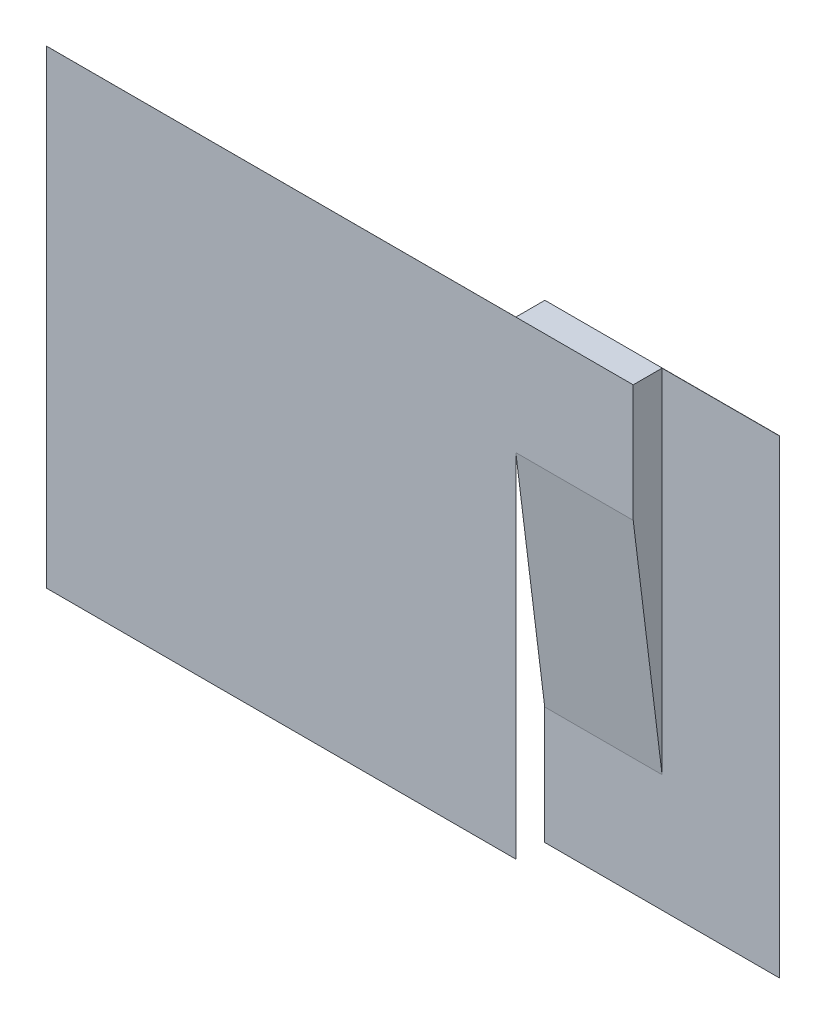
from build123d import *

# Parameters (mm, degrees)
SKETCH1_W           = 1220
SKETCH1_H           = 2440
BOSS_EXTRUDE1_DEPTH = 1
SKETCH2_W           = 610
SKETCH2_H           = 150
BOSS_EXTRUDE2_DEPTH = 1830
SKETCH3_W           = 0.1
SKETCH3_H           = 1830
BOSS_EXTRUDE3_DEPTH = 2440
SKETCH4_W           = 2440
SKETCH4_H           = 0.1
BOSS_EXTRUDE4_DEPTH = 610
DRAFT1_ANGLE        = 82.990615743


with BuildPart() as part:
    # Sketch1 → Boss-Extrude1 (new body)
    with BuildSketch(Plane(origin=(0, 0, -425.609273672), x_dir=(-1, 0, 0), z_dir=(0, 0, -1))):
        with Locations((-305, -681.820483208)):
            Rectangle(SKETCH1_W, SKETCH1_H)
    extrude(amount=-BOSS_EXTRUDE1_DEPTH)

    # Sketch2 → Boss-Extrude2 (add)
    with BuildSketch(Plane(origin=(0, 538.179516792, 0), x_dir=(1, 0, 0), z_dir=(0, 1, 0))):
        with Locations((0, 349.609273672)):
            Rectangle(SKETCH2_W, SKETCH2_H)
    extrude(amount=-BOSS_EXTRUDE2_DEPTH)

    # Sketch3 → Boss-Extrude3 (add)
    with BuildSketch(Plane.ZY.offset(305)):
        with Locations((-274.659273672, -376.820483208)):
            Rectangle(SKETCH3_W, SKETCH3_H)
    extrude(amount=BOSS_EXTRUDE3_DEPTH)

    # Sketch4 → Boss-Extrude4 (add)
    with BuildSketch(Plane.XZ.offset(1291.820483208)):
        with Locations((-1525, -274.659273672)):
            Rectangle(SKETCH4_W, SKETCH4_H)
    extrude(amount=BOSS_EXTRUDE4_DEPTH)

    # Draft1
    draft1_faces = [part.faces().sort_by_distance(p)[0] for p in [
        (0, -1291.820483208, -349.609273672),
    ]]
    draft(draft1_faces, Plane.XY.offset(-424.609273672), DRAFT1_ANGLE)


solid = part.part
